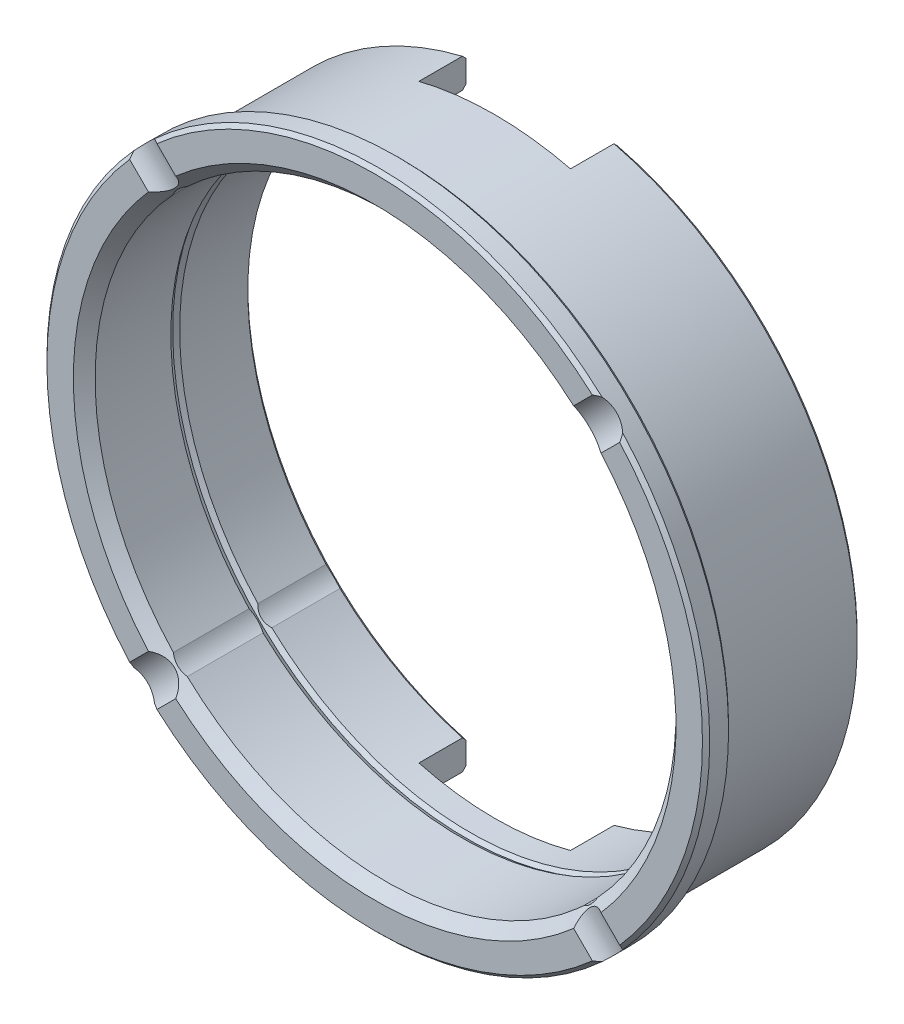
from build123d import *

# Parameters (mm, degrees)
SKETCH33_MESH_154_R                  = 4.25
CUT_EXTRUDE1_DEPTH                   = 69.616925755
SKETCH34_MESH_158_R                  = 3.9
EXTRUDE21_CUT_159_DEPTH              = 22.5
CIRPATTERN1_COUNT                    = 4
CUT_EXTRUDE11_REACH                  = 69.103
CUT_EXTRUDE11_END_RADIUS             = 44
SKETCH35_MESH_161_W                  = 20.9
SKETCH35_MESH_161_H                  = 6.5
CUT_EXTRUDE11_DIRECTION_2_REACH      = 69.103
CUT_EXTRUDE11_DIRECTION_2_END_RADIUS = 44


with BuildPart() as part:
    # Sketch32 (Mesh)_152 → Revolve1 (revolve)
    with BuildSketch(Plane(origin=(0, 0, 0), x_dir=(0, 0, -1), z_dir=(1, 0, 0)), mode=Mode.PRIVATE) as revolve1_sk:
        Polygon((-16.55, -40.05), (-6.106217783, -40.05), (-5.5, -40.4), (-4.893782217, -40.05), (4.5, -40.05), (5, -40.55), (5, -43.5), (4.5, -44), (-14.45, -44), (-14.45, -45.2), (-14.95, -45.7), (-17.55, -45.7), (-18.05, -45.2), (-18.05, -41.55), align=None)
    revolve(revolve1_sk.sketch.rotate(Axis((0, 0, 0), (0, 0, 1)), 180), axis=Axis((0, 0, 0), (0, 0, 1)))

    # Sketch33 (Mesh)_154 → Cut-Extrude1 (cut, through all)
    with BuildSketch(Plane.XY.offset(18.05)):
        with Locations((-25.455844123, 25.455844123)):
            Circle(SKETCH33_MESH_154_R)
    cut_extrude1 = extrude(amount=-CUT_EXTRUDE1_DEPTH, mode=Mode.SUBTRACT)

    # Sketch34 (Mesh)_158 → Extrude21 (Cut)_159 (cut, symmetric)
    with BuildSketch(Plane(origin=(-28.319626587, 28.319626587, 0), x_dir=(-0.7071067811865464, -0.7071067811865488, 0), z_dir=(0.7071067811865488, -0.7071067811865464, 0))):
        with Locations((0, -20.9)):
            Circle(SKETCH34_MESH_158_R)
    extrude21_cut_159 = extrude(amount=EXTRUDE21_CUT_159_DEPTH, both=True, mode=Mode.SUBTRACT)

    # CirPattern1: Cut-Extrude1, Extrude21 (Cut)_159 ×4 about axis
    cirpattern1_axis = Axis((0, 0, 0), (0, 0, 1))
    add([cut_extrude1.rotate(cirpattern1_axis, i * 360 / CIRPATTERN1_COUNT) for i in range(1, CIRPATTERN1_COUNT)], mode=Mode.SUBTRACT)
    add([extrude21_cut_159.rotate(cirpattern1_axis, i * 360 / CIRPATTERN1_COUNT) for i in range(1, CIRPATTERN1_COUNT)], mode=Mode.SUBTRACT)

    # Cut-Extrude11: up to this cylinder (the profile starts inside it)
    cut_extrude11_end = Plane(origin=(0, 0, -1.75), z_dir=(0, 0, -1)) * Cylinder(CUT_EXTRUDE11_END_RADIUS, 227.206, mode=Mode.PRIVATE)
    # Sketch35 (Mesh)_161 → Cut-Extrude11 (cut, up to the surface)
    with BuildSketch(Plane(origin=(0, 0, 0), x_dir=(1, 0, 0), z_dir=(0, 1, 0)), mode=Mode.PRIVATE) as cut_extrude11_sk1:
        with Locations((0, 1.75)):
            Rectangle(SKETCH35_MESH_161_W, SKETCH35_MESH_161_H)
    cut_extrude11_tool1 = extrude(cut_extrude11_sk1.sketch, amount=CUT_EXTRUDE11_REACH, mode=Mode.PRIVATE) & cut_extrude11_end
    add(cut_extrude11_tool1.solids().sort_by_distance((0, 0, -1.75))[0], mode=Mode.SUBTRACT)

    # Cut-Extrude11 direction 2: up to this cylinder (the profile starts inside it)
    cut_extrude11_direction_2_end = Plane(origin=(0, 0, -1.75), z_dir=(0, 0, -1)) * Cylinder(CUT_EXTRUDE11_DIRECTION_2_END_RADIUS, 227.206, mode=Mode.PRIVATE)
    # Sketch35 (Mesh)_161 → Cut-Extrude11 direction 2 (cut, up to the surface)
    with BuildSketch(Plane(origin=(0, 0, 0), x_dir=(1, 0, 0), z_dir=(0, 1, 0)), mode=Mode.PRIVATE) as cut_extrude11_direction_2_sk1:
        with Locations((0, 1.75)):
            Rectangle(SKETCH35_MESH_161_W, SKETCH35_MESH_161_H)
    cut_extrude11_direction_2_tool1 = extrude(cut_extrude11_direction_2_sk1.sketch, amount=-CUT_EXTRUDE11_DIRECTION_2_REACH, mode=Mode.PRIVATE) & cut_extrude11_direction_2_end
    add(cut_extrude11_direction_2_tool1.solids().sort_by_distance((0, 0, -1.75))[0], mode=Mode.SUBTRACT)


solid = part.part
